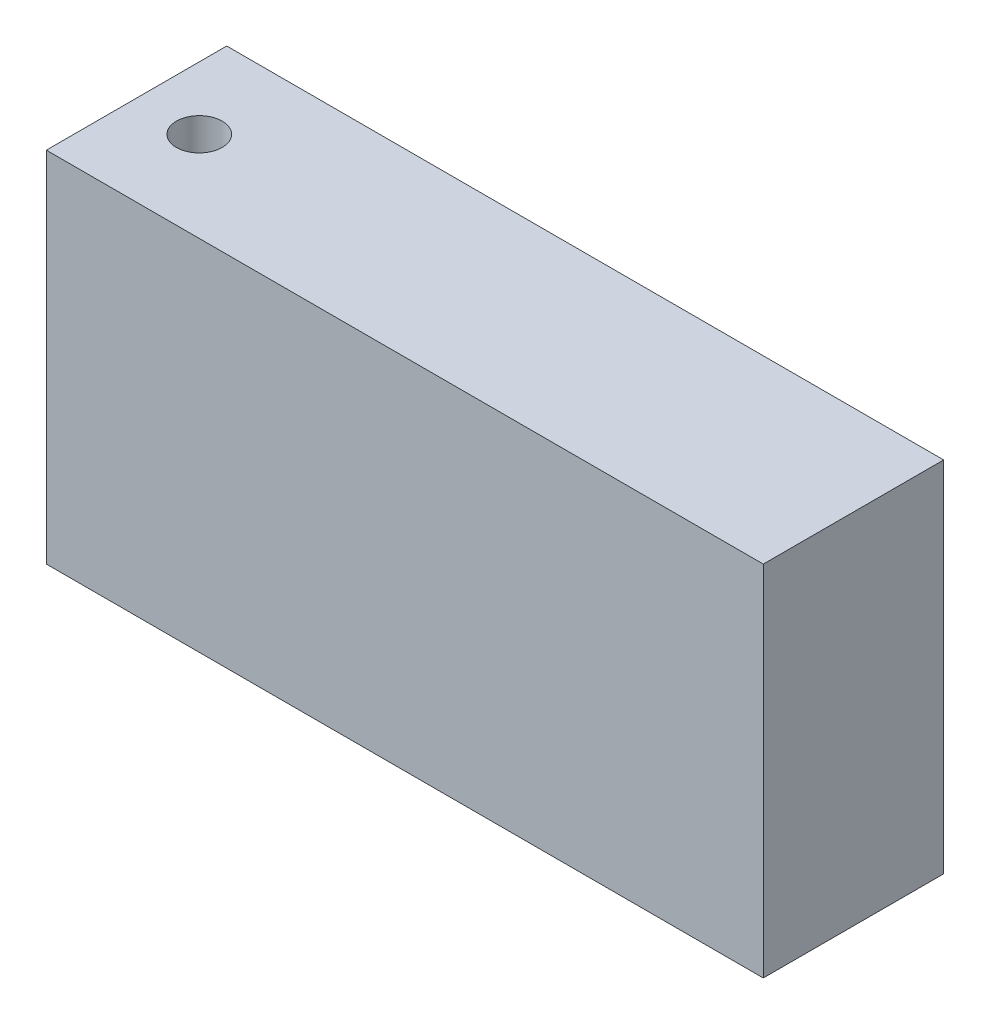
from build123d import *

# Parameters (mm, degrees)
SKETCH1_W           = 100
SKETCH1_H           = 25.16
BOSS_EXTRUDE1_DEPTH = 50
SKETCH2_R           = 3.19
CUT_EXTRUDE1_DEPTH  = 8


with BuildPart() as part:
    # Sketch1 → Boss-Extrude1 (new body)
    with BuildSketch(Plane(origin=(0, 0, 0), x_dir=(1, 0, 0), z_dir=(0, 1, 0))):
        Rectangle(SKETCH1_W, SKETCH1_H)
    extrude(amount=BOSS_EXTRUDE1_DEPTH)

    # Sketch2 → Cut-Extrude1 (cut)
    with BuildSketch(Plane(origin=(0, 50, 0), x_dir=(1, 0, 0), z_dir=(0, 1, 0))):
        with Locations(Location((-41.25, 0, 0), (0, 0, 270))):
            Circle(SKETCH2_R)
    extrude(amount=-CUT_EXTRUDE1_DEPTH, mode=Mode.SUBTRACT)


solid = part.part
